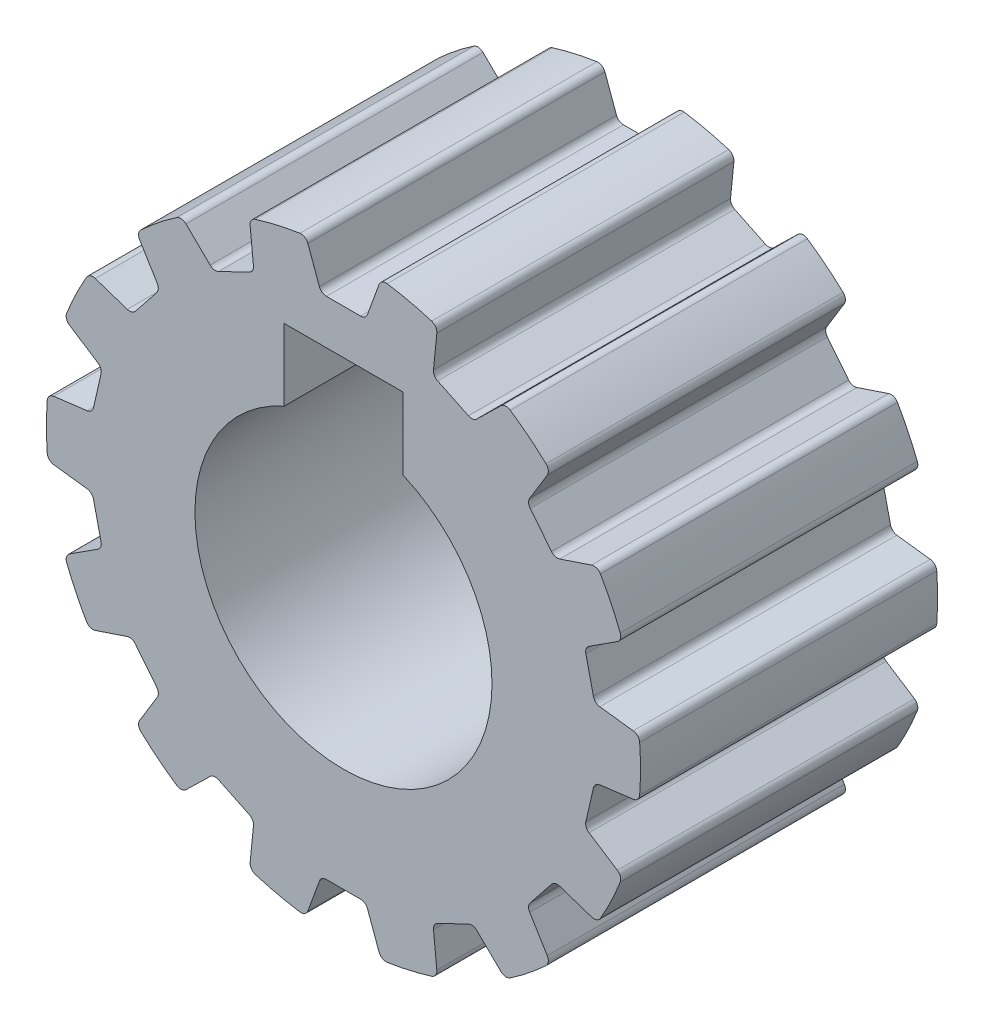
from build123d import *

# Parameters (mm, degrees)
SKETCH1_R           = 10
BOSS_EXTRUDE1_DEPTH = 10
CUT_EXTRUDE1_DEPTH  = 18.320508076
CIRPATTERN1_COUNT   = 14
FILLET1_R           = 0.25


with BuildPart() as part:
    # Sketch1 → Boss-Extrude1 (new body)
    with BuildSketch(Plane.XY):
        Circle(SKETCH1_R)
        with BuildLine():
            Line((2, 7), (-2, 7))
            Line((-2, 7), (-2, 4.582575695))
            ThreePointArc((-2, 4.582575695), (0, -5), (2, 4.582575695))
            Line((2, 4.582575695), (2, 7))
        make_face(mode=Mode.SUBTRACT)
    extrude(amount=BOSS_EXTRUDE1_DEPTH)

    # Sketch2 → Cut-Extrude1 (cut, through all)
    with BuildSketch(Plane.XY.offset(10)):
        with BuildLine():
            Line((-0.75, 8.5), (0, 8.5))
            Line((0, 8.5), (0, 10))
            ThreePointArc((0, 10), (-0.634599116, 9.979843885), (-1.266640021, 9.919456792))
            Line((-1.266640021, 9.919456792), (-0.75, 8.5))
        make_face()
        with BuildLine():
            Line((0, 10), (0, 8.5))
            Line((0, 8.5), (0.75, 8.5))
            Line((0.75, 8.5), (1.266640021, 9.919456792))
            ThreePointArc((1.266640021, 9.919456792), (0.634599116, 9.979843885), (0, 10))
        make_face()
    cut_extrude1 = extrude(amount=-CUT_EXTRUDE1_DEPTH, mode=Mode.SUBTRACT)

    # CirPattern1: Cut-Extrude1 ×14 about axis
    cirpattern1_axis = Axis((0, 0, 0), (0, 0, 1))
    for i in range(1, CIRPATTERN1_COUNT):
        add(cut_extrude1.rotate(cirpattern1_axis, i * 360 / CIRPATTERN1_COUNT), mode=Mode.SUBTRACT)

    # Fillet1
    fillet1_edges = [part.edges().sort_by_distance(p)[0] for p in [
        (8.453777954, 1.160232004, 5),
        (8.119996553, 2.622623873, 5),
        (9.38890138, 3.442169501, 5),
        (9.952609221, 0.972404078, 5),
        (8.119996553, -2.622623873, 5),
        (8.453777954, -1.160232004, 5),
        (9.952609221, -0.972404078, 5),
        (9.38890138, -3.442169501, 5),
        (6.17795025, -5.886036928, 5),
        (7.113184952, -4.713289704, 5),
        (8.545080745, -5.194381104, 5),
        (6.965606473, -7.174979196, 5),
        (3.012285132, -7.983648182, 5),
        (4.363738433, -7.332822573, 5),
        (5.445094229, -8.387547248, 5),
        (3.162687777, -9.486696265, 5),
        (-0.75, -8.5, 5),
        (0.75, -8.5, 5),
        (1.266640021, -9.919456792, 5),
        (-1.266640021, -9.919456792, 5),
        (-4.363738433, -7.332822573, 5),
        (-3.012285132, -7.983648182, 5),
        (-3.162687777, -9.486696265, 5),
        (-5.445094229, -8.387547248, 5),
        (-7.113184952, -4.713289704, 5),
        (-6.17795025, -5.886036928, 5),
        (-6.965606473, -7.174979196, 5),
        (-8.545080745, -5.194381104, 5),
        (-8.453777954, -1.160232004, 5),
        (-8.119996553, -2.622623873, 5),
        (-9.38890138, -3.442169501, 5),
        (-9.952609221, -0.972404078, 5),
        (-8.119996553, 2.622623873, 5),
        (-8.453777954, 1.160232004, 5),
        (-9.952609221, 0.972404078, 5),
        (-9.38890138, 3.442169501, 5),
        (-6.17795025, 5.886036928, 5),
        (-7.113184952, 4.713289704, 5),
        (-8.545080745, 5.194381104, 5),
        (-6.965606473, 7.174979196, 5),
        (-3.012285132, 7.983648182, 5),
        (-4.363738433, 7.332822573, 5),
        (-5.445094229, 8.387547248, 5),
        (-3.162687777, 9.486696265, 5),
        (4.363738433, 7.332822573, 5),
        (3.012285132, 7.983648182, 5),
        (3.162687777, 9.486696265, 5),
        (5.445094229, 8.387547248, 5),
        (0.75, 8.5, 5),
        (-0.75, 8.5, 5),
        (-1.266640021, 9.919456792, 5),
        (1.266640021, 9.919456792, 5),
        (7.113184952, 4.713289704, 5),
        (6.17795025, 5.886036928, 5),
        (6.965606473, 7.174979196, 5),
        (8.545080745, 5.194381104, 5),
    ]]
    fillet(fillet1_edges, radius=FILLET1_R)


solid = part.part
